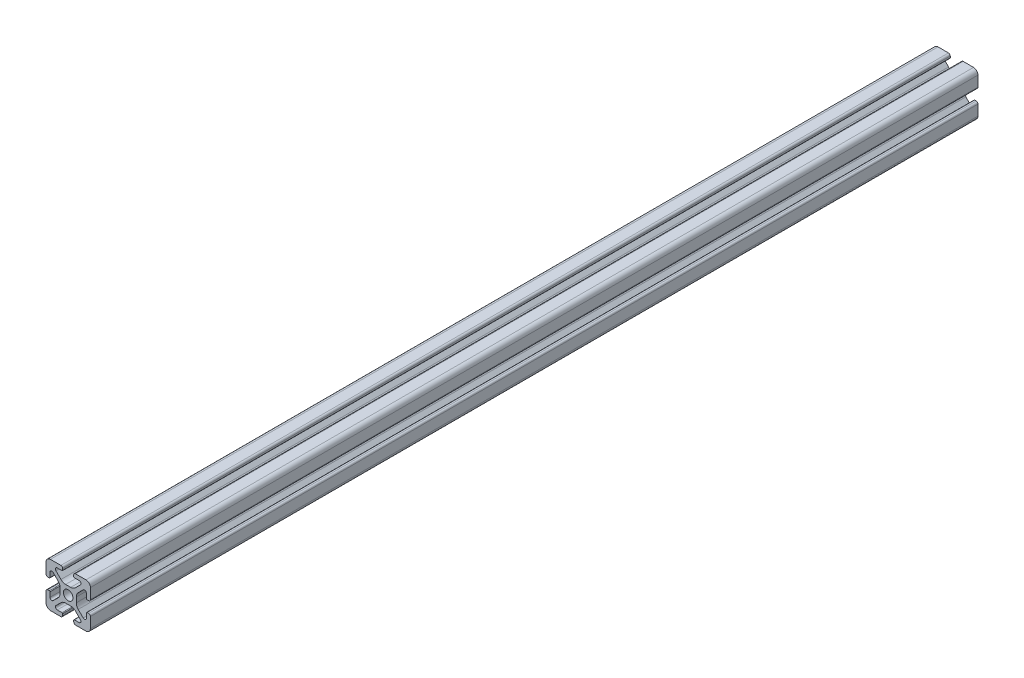
from build123d import *

# Parameters (mm, degrees)
BOSS_EXTRU_1_DEPTH = 400


with BuildPart() as part:
    # Esquisse1 → Boss.-Extru.1 (new body)
    with BuildSketch(Plane.XY):
        with BuildLine():
            Line((-3.255887446, 4.528679645), (-5.506192286, 6.778984485))
            ThreePointArc((-5.506192286, 6.778984485), (-5.686636441, 7.686138511), (-4.917588391, 8.199999989))
            Line((-4.917588391, 8.199999989), (-2.799999991, 8.199999989))
            ThreePointArc((-2.799999991, 8.199999989), (-2.587867957, 8.287867955), (-2.499999991, 8.499999989))
            Line((-2.499999991, 8.499999989), (-2.499999991, 9.199999989))
            ThreePointArc((-2.499999991, 9.199999989), (-2.734314566, 9.765685414), (-3.299999991, 9.999999989))
            Line((-3.299999991, 9.999999989), (-7.999999991, 9.999999989))
            ThreePointArc((-7.999999991, 9.999999989), (-9.414213554, 9.414213552), (-9.999999991, 7.999999989))
            Line((-9.999999991, 7.999999989), (-9.999999991, 3.299999989))
            ThreePointArc((-9.999999991, 3.299999989), (-9.765685416, 2.734314564), (-9.199999991, 2.499999989))
            Line((-9.199999991, 2.499999989), (-8.499999991, 2.499999989))
            ThreePointArc((-8.499999991, 2.499999989), (-8.287867957, 2.587867955), (-8.199999991, 2.799999989))
            Line((-8.199999991, 2.799999989), (-8.199999991, 4.917588389))
            ThreePointArc((-8.199999991, 4.917588389), (-7.686138517, 5.686636433), (-6.778984497, 5.506192279))
            Line((-6.778984497, 5.506192279), (-4.528679657, 3.255887439))
            ThreePointArc((-4.528679657, 3.255887439), (-3.878361403, 2.282617393), (-3.650000001, 1.134567096))
            Line((-3.650000001, 1.134567096), (-3.650000001, -1.134567114))
            ThreePointArc((-3.650000001, -1.134567114), (-3.878361403, -2.282617409), (-4.528679656, -3.255887454))
            Line((-4.528679656, -3.255887454), (-6.778984496, -5.506192294))
            ThreePointArc((-6.778984496, -5.506192294), (-7.686138522, -5.686636449), (-8.2, -4.9175884))
            Line((-8.2, -4.9175884), (-8.2, -2.8))
            ThreePointArc((-8.2, -2.8), (-8.287867966, -2.587867966), (-8.5, -2.5))
            Line((-8.5, -2.5), (-9.2, -2.5))
            ThreePointArc((-9.2, -2.5), (-9.765685425, -2.734314575), (-10, -3.3))
            Line((-10, -3.3), (-10, -8))
            ThreePointArc((-10, -8), (-9.414213562, -9.414213562), (-8, -10))
            Line((-8, -10), (-3.3, -10))
            ThreePointArc((-3.3, -10), (-2.734314575, -9.765685425), (-2.5, -9.2))
            Line((-2.5, -9.2), (-2.5, -8.5))
            ThreePointArc((-2.5, -8.5), (-2.587867966, -8.287867966), (-2.8, -8.2))
            Line((-2.8, -8.2), (-4.9175884, -8.2))
            ThreePointArc((-4.9175884, -8.2), (-5.686636444, -7.686138526), (-5.50619229, -6.778984506))
            Line((-5.50619229, -6.778984506), (-3.25588745, -4.528679666))
            ThreePointArc((-3.25588745, -4.528679666), (-2.282617404, -3.878361412), (-1.134567106, -3.650000009))
            Line((-1.134567106, -3.650000009), (1.134567104, -3.650000009))
            ThreePointArc((1.134567104, -3.650000009), (2.282617399, -3.878361412), (3.255887444, -4.528679664))
            Line((3.255887444, -4.528679664), (5.506192284, -6.778984504))
            ThreePointArc((5.506192284, -6.778984504), (5.686636439, -7.686138531), (4.917588389, -8.200000009))
            Line((4.917588389, -8.200000009), (2.799999989, -8.200000009))
            ThreePointArc((2.799999989, -8.200000009), (2.587867955, -8.287867974), (2.499999989, -8.500000009))
            Line((2.499999989, -8.500000009), (2.499999989, -9.200000009))
            ThreePointArc((2.499999989, -9.200000009), (2.734314564, -9.765685434), (3.299999989, -10.000000009))
            Line((3.299999989, -10.000000009), (7.999999989, -10.000000009))
            ThreePointArc((7.999999989, -10.000000009), (9.414213552, -9.414213571), (9.999999989, -8.000000009))
            Line((9.999999989, -8.000000009), (9.999999989, -3.300000009))
            ThreePointArc((9.999999989, -3.300000009), (9.765685414, -2.734314584), (9.199999989, -2.500000009))
            Line((9.199999989, -2.500000009), (8.499999989, -2.500000009))
            ThreePointArc((8.499999989, -2.500000009), (8.287867955, -2.587867974), (8.199999989, -2.800000009))
            Line((8.199999989, -2.800000009), (8.199999989, -4.917588409))
            ThreePointArc((8.199999989, -4.917588409), (7.686138515, -5.686636452), (6.778984495, -5.506192299))
            Line((6.778984495, -5.506192299), (4.528679655, -3.255887459))
            ThreePointArc((4.528679655, -3.255887459), (3.878361401, -2.282617412), (3.649999999, -1.134567115))
            Line((3.649999999, -1.134567115), (3.649999999, 1.134567095))
            ThreePointArc((3.649999999, 1.134567095), (3.878361401, 2.28261739), (4.528679654, 3.255887435))
            Line((4.528679654, 3.255887435), (6.778984494, 5.506192275))
            ThreePointArc((6.778984494, 5.506192275), (7.68613852, 5.68663643), (8.199999998, 4.917588381))
            Line((8.199999998, 4.917588381), (8.199999998, 2.799999981))
            ThreePointArc((8.199999998, 2.799999981), (8.287867964, 2.587867946), (8.499999998, 2.499999981))
            Line((8.499999998, 2.499999981), (9.199999998, 2.499999981))
            ThreePointArc((9.199999998, 2.499999981), (9.765685423, 2.734314556), (9.999999998, 3.299999981))
            Line((9.999999998, 3.299999981), (9.999999998, 7.999999981))
            ThreePointArc((9.999999998, 7.999999981), (9.41421356, 9.414213543), (7.999999998, 9.999999981))
            Line((7.999999998, 9.999999981), (3.299999998, 9.999999981))
            ThreePointArc((3.299999998, 9.999999981), (2.734314573, 9.765685406), (2.499999998, 9.199999981))
            Line((2.499999998, 9.199999981), (2.499999998, 8.499999981))
            ThreePointArc((2.499999998, 8.499999981), (2.587867964, 8.287867946), (2.799999998, 8.199999981))
            Line((2.799999998, 8.199999981), (4.917588398, 8.199999981))
            ThreePointArc((4.917588398, 8.199999981), (5.686636442, 7.686138507), (5.506192288, 6.778984487))
            Line((5.506192288, 6.778984487), (3.255887448, 4.528679647))
            ThreePointArc((3.255887448, 4.528679647), (2.282617402, 3.878361393), (1.134567104, 3.64999999))
            Line((1.134567104, 3.64999999), (-1.134567106, 3.64999999))
            ThreePointArc((-1.134567106, 3.64999999), (-2.282617401, 3.878361392), (-3.255887446, 4.528679645))
        make_face()
        with BuildLine():
            ThreePointArc((-2.15, 0), (0, -2.15), (2.15, 0))
            ThreePointArc((2.15, 0), (0, 2.15), (-2.15, 0))
        make_face(mode=Mode.SUBTRACT)
    extrude(amount=BOSS_EXTRU_1_DEPTH)


solid = part.part
